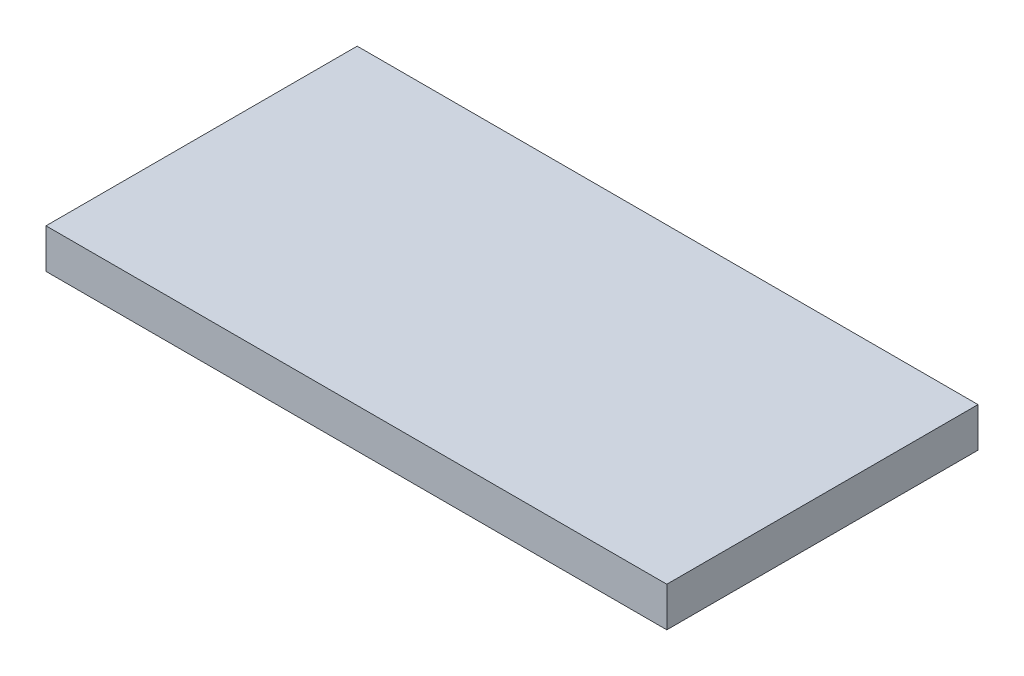
from build123d import *

# Parameters (mm, degrees)
CROQUIS1_W              = 798
CROQUIS1_H              = 400
SALIENTE_EXTRUIR1_DEPTH = 50.8
VACIADO1_T              = -1.9


with BuildPart() as part:
    # Croquis1 → Saliente-Extruir1 (new body)
    with BuildSketch(Plane(origin=(0, 0, 0), x_dir=(1, 0, 0), z_dir=(0, 1, 0))):
        Rectangle(CROQUIS1_W, CROQUIS1_H)
    extrude(amount=SALIENTE_EXTRUIR1_DEPTH)

    # Vaciado1
    vaciado1_openings = [part.faces().sort_by_distance(p)[0] for p in [
        (0, 0, 0),
    ]]
    offset(amount=VACIADO1_T, openings=vaciado1_openings, kind=Kind.INTERSECTION)


solid = part.part
